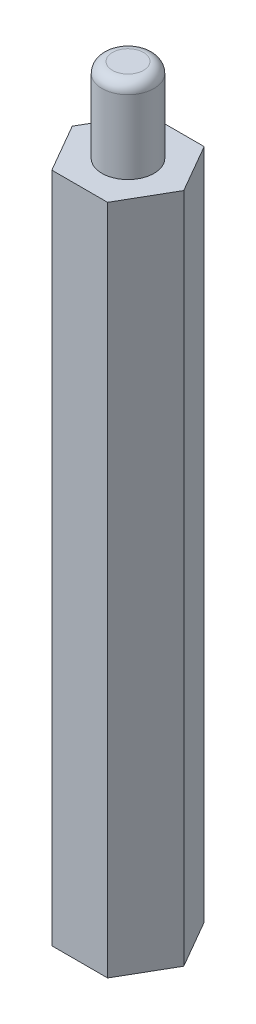
from build123d import *

# Parameters (mm, degrees)
SALIENTE_EXTRUIR1_DEPTH = 32
CROQUIS_SUPERIOR_R      = 1.24
SALIENTE_EXTRUIR2_DEPTH = 4
REDONDEO1_R             = 0.5
CROQUIS_INFERIOR_R      = 1.25
CORTAR_EXTRUIR1_DEPTH   = 4


with BuildPart() as part:
    # Croquis base → Saliente-Extruir1 (new body)
    with BuildSketch(Plane(origin=(0, 0, 0), x_dir=(1, 0, 0), z_dir=(0, 1, 0))):
        Polygon((2.655811238, 0), (1.327905619, 2.3), (-1.327905619, 2.3), (-2.655811238, 0), (-1.327905619, -2.3), (1.327905619, -2.3), align=None)
    extrude(amount=SALIENTE_EXTRUIR1_DEPTH)

    # Croquis Superior → Saliente-Extruir2 (add)
    with BuildSketch(Plane(origin=(0, 32, 0), x_dir=(1, 0, 0), z_dir=(0, 1, 0))):
        with Locations(Location((0, 0, 0), (0, 0, 270))):
            Circle(CROQUIS_SUPERIOR_R)
    extrude(amount=SALIENTE_EXTRUIR2_DEPTH)

    # Redondeo1
    redondeo1_edges = [part.edges().sort_by_distance(p)[0] for p in [
        (0, 36, -1.24),
    ]]
    fillet(redondeo1_edges, radius=REDONDEO1_R)

    # Croquis inferior → Cortar-Extruir1 (cut)
    with BuildSketch(Plane(origin=(0, 0, 0), x_dir=(-1, 0, 0), z_dir=(0, -1, 0))):
        with Locations(Location((0, 0, 0), (0, 0, 90))):
            Circle(CROQUIS_INFERIOR_R)
    extrude(amount=-CORTAR_EXTRUIR1_DEPTH, mode=Mode.SUBTRACT)


solid = part.part
